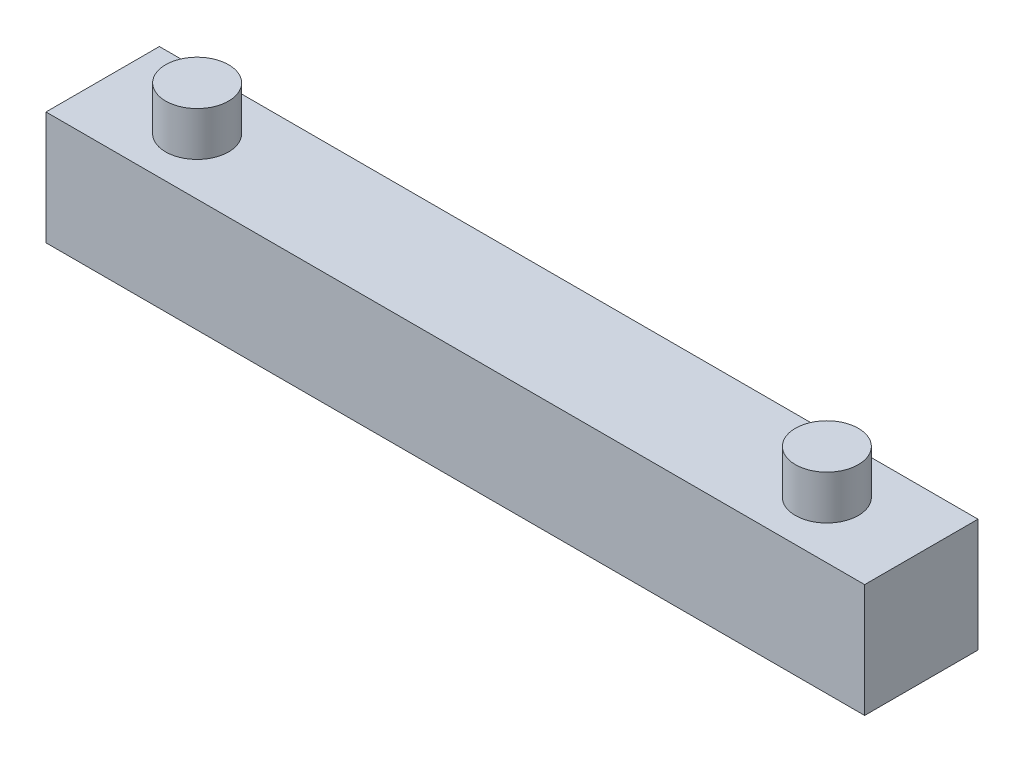
from build123d import *

# Parameters (mm, degrees)
SKETCH_1_W      = 65
SKETCH_1_H      = 9
EXTRUDE_1_DEPTH = 9
EXTRUDE_2_DEPTH = 3.5
SKETCH_3_R      = 2.5
EXTRUDE_3_DEPTH = 3.5


with BuildPart() as part:
    # 草圖1 → 填料-伸長1 (new body)
    with BuildSketch(Plane(origin=(0, 0, 0), x_dir=(1, 0, 0), z_dir=(0, 1, 0))):
        with Locations((32.5, -4.5)):
            Rectangle(SKETCH_1_W, SKETCH_1_H)
    extrude(amount=EXTRUDE_1_DEPTH)

    # 草圖2 → 填料-伸長2 (add)
    with BuildSketch(Plane(origin=(0, 9, 0), x_dir=(1, 0, 0), z_dir=(0, 1, 0))):
        with BuildLine():
            ThreePointArc((10, -4.5), (9.267766953, -2.732233047), (7.5, -2))
            Line((7.5, -2), (7.5, -4.5))
            Line((7.5, -4.5), (10, -4.5))
        make_face()
        with BuildLine():
            Line((7.5, -4.5), (7.5, -2))
            ThreePointArc((7.5, -2), (5.732233047, -2.732233047), (5, -4.5))
            Line((5, -4.5), (7.5, -4.5))
        make_face()
        with BuildLine():
            Line((10, -4.5), (7.5, -4.5))
            Line((7.5, -4.5), (7.5, -7))
            ThreePointArc((7.5, -7), (9.267766953, -6.267766953), (10, -4.5))
        make_face()
        with BuildLine():
            Line((7.5, -7), (7.5, -4.5))
            Line((7.5, -4.5), (5, -4.5))
            ThreePointArc((5, -4.5), (5.732233047, -6.267766953), (7.5, -7))
        make_face()
    extrude(amount=EXTRUDE_2_DEPTH)

    # 草圖3 → 填料-伸長3 (add)
    with BuildSketch(Plane(origin=(0, 9, 0), x_dir=(1, 0, 0), z_dir=(0, 1, 0))):
        with Locations(Location((57.5, -4.5, 0), (0, 0, 270))):
            Circle(SKETCH_3_R)
    extrude(amount=EXTRUDE_3_DEPTH)


solid = part.part
